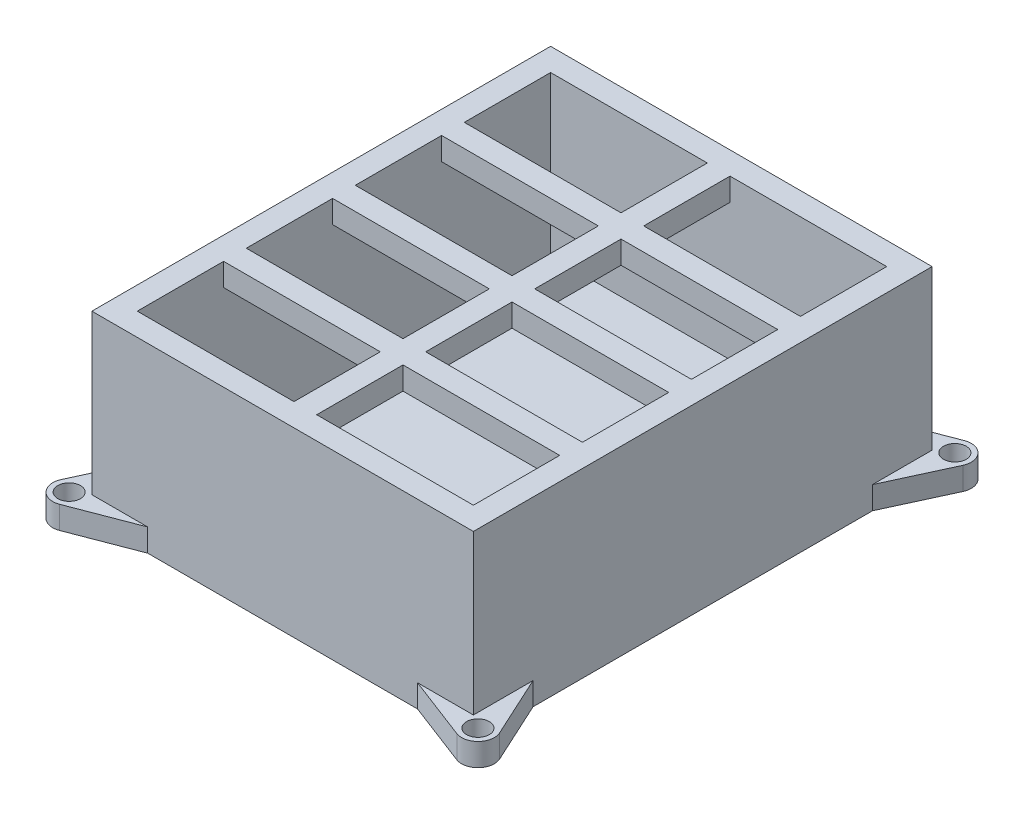
from build123d import *

# Parameters (mm, degrees)
SKETCH1_W           = 16.8
SKETCH1_H           = 20.2
SKETCH1_W_2         = 6.9
SKETCH1_H_2         = 3.8
BOSS_EXTRUDE1_DEPTH = 1
SKETCH2_W           = 16.8
SKETCH2_H           = 20.2
SKETCH2_W_2         = 6.9
SKETCH2_H_2         = 3.8
BOSS_EXTRUDE2_DEPTH = 1
SKETCH4_W           = 16.8
SKETCH4_H           = 20.2
SKETCH4_W_2         = 14.8
SKETCH4_H_2         = 18.2
BOSS_EXTRUDE3_DEPTH = 6
SKETCH5_R           = 0.5
BOSS_EXTRUDE4_DEPTH = 1


with BuildPart() as part:
    # Sketch1 → Boss-Extrude1 (new body)
    # profile 1 of 9: a face of its own
    with BuildSketch(Plane(origin=(0, 0, 0), x_dir=(1, 0, 0), z_dir=(0, 1, 0))):
        Rectangle(SKETCH1_W, SKETCH1_H)
        with Locations((3.95, 7.2)):
            Rectangle(SKETCH1_W_2, SKETCH1_H_2, mode=Mode.SUBTRACT)
        with Locations((3.95, 2.4)):
            Rectangle(SKETCH1_W_2, SKETCH1_H_2, mode=Mode.SUBTRACT)
        with Locations((-3.95, -2.4)):
            Rectangle(SKETCH1_W_2, SKETCH1_H_2, mode=Mode.SUBTRACT)
        with Locations((-3.95, -7.2)):
            Rectangle(SKETCH1_W_2, SKETCH1_H_2, mode=Mode.SUBTRACT)
        with Locations((3.95, -7.2)):
            Rectangle(SKETCH1_W_2, SKETCH1_H_2, mode=Mode.SUBTRACT)
        with Locations((3.95, -2.4)):
            Rectangle(SKETCH1_W_2, SKETCH1_H_2, mode=Mode.SUBTRACT)
        with Locations((-3.95, 7.2)):
            Rectangle(SKETCH1_W_2, SKETCH1_H_2, mode=Mode.SUBTRACT)
        with Locations((-3.95, 2.4)):
            Rectangle(SKETCH1_W_2, SKETCH1_H_2, mode=Mode.SUBTRACT)
    # profile 2 of 9: a face of its own
    with BuildSketch(Plane(origin=(0, 0, 0), x_dir=(1, 0, 0), z_dir=(0, 1, 0))):
        with Locations((-3.95, 2.4)):
            Rectangle(SKETCH1_W_2, SKETCH1_H_2)
    # profile 3 of 9: a face of its own
    with BuildSketch(Plane(origin=(0, 0, 0), x_dir=(1, 0, 0), z_dir=(0, 1, 0))):
        with Locations((-3.95, 7.2)):
            Rectangle(SKETCH1_W_2, SKETCH1_H_2)
    # profile 4 of 9: a face of its own
    with BuildSketch(Plane(origin=(0, 0, 0), x_dir=(1, 0, 0), z_dir=(0, 1, 0))):
        with Locations((3.95, 7.2)):
            Rectangle(SKETCH1_W_2, SKETCH1_H_2)
    # profile 5 of 9: a face of its own
    with BuildSketch(Plane(origin=(0, 0, 0), x_dir=(1, 0, 0), z_dir=(0, 1, 0))):
        with Locations((3.95, 2.4)):
            Rectangle(SKETCH1_W_2, SKETCH1_H_2)
    # profile 6 of 9: a face of its own
    with BuildSketch(Plane(origin=(0, 0, 0), x_dir=(1, 0, 0), z_dir=(0, 1, 0))):
        with Locations((3.95, -2.4)):
            Rectangle(SKETCH1_W_2, SKETCH1_H_2)
    # profile 7 of 9: a face of its own
    with BuildSketch(Plane(origin=(0, 0, 0), x_dir=(1, 0, 0), z_dir=(0, 1, 0))):
        with Locations((-3.95, -2.4)):
            Rectangle(SKETCH1_W_2, SKETCH1_H_2)
    # profile 8 of 9: a face of its own
    with BuildSketch(Plane(origin=(0, 0, 0), x_dir=(1, 0, 0), z_dir=(0, 1, 0))):
        with Locations((-3.95, -7.2)):
            Rectangle(SKETCH1_W_2, SKETCH1_H_2)
    # profile 9 of 9: a face of its own
    with BuildSketch(Plane(origin=(0, 0, 0), x_dir=(1, 0, 0), z_dir=(0, 1, 0))):
        with Locations((3.95, -7.2)):
            Rectangle(SKETCH1_W_2, SKETCH1_H_2)
    extrude(amount=BOSS_EXTRUDE1_DEPTH)



with BuildPart() as body_2:
    # Sketch2 → Boss-Extrude2 (new body)
    with BuildSketch(Plane(origin=(0, 7, 0), x_dir=(1, 0, 0), z_dir=(0, 1, 0))):
        Rectangle(SKETCH2_W, SKETCH2_H)
        with Locations((-3.95, -7.2)):
            Rectangle(SKETCH2_W_2, SKETCH2_H_2, mode=Mode.SUBTRACT)
        with Locations((3.95, -7.2)):
            Rectangle(SKETCH2_W_2, SKETCH2_H_2, mode=Mode.SUBTRACT)
        with Locations((3.95, -2.4)):
            Rectangle(SKETCH2_W_2, SKETCH2_H_2, mode=Mode.SUBTRACT)
        with Locations((-3.95, -2.4)):
            Rectangle(SKETCH2_W_2, SKETCH2_H_2, mode=Mode.SUBTRACT)
        with Locations((-3.95, 2.4)):
            Rectangle(SKETCH2_W_2, SKETCH2_H_2, mode=Mode.SUBTRACT)
        with Locations((3.95, 2.4)):
            Rectangle(SKETCH2_W_2, SKETCH2_H_2, mode=Mode.SUBTRACT)
        with Locations((3.95, 7.2)):
            Rectangle(SKETCH2_W_2, SKETCH2_H_2, mode=Mode.SUBTRACT)
        with Locations((-3.95, 7.2)):
            Rectangle(SKETCH2_W_2, SKETCH2_H_2, mode=Mode.SUBTRACT)
    extrude(amount=BOSS_EXTRUDE2_DEPTH)


with BuildPart() as part_1:
    add(part.part)

    add(body_2.part)  # Boss-Extrude3 merges body 2
    # Sketch4 → Boss-Extrude3 (add)
    with BuildSketch(Plane(origin=(0, 1, 0), x_dir=(1, 0, 0), z_dir=(0, 1, 0))):
        Rectangle(SKETCH4_W, SKETCH4_H)
        Rectangle(SKETCH4_W_2, SKETCH4_H_2, mode=Mode.SUBTRACT)
    extrude(amount=BOSS_EXTRUDE3_DEPTH)

    # Sketch5 → Boss-Extrude4 (add)
    # profile 1 of 4: a face of its own
    with BuildSketch(Plane.XZ):
        with BuildLine():
            Line((8.4, 7.47345081), (9.654981825, 10.198339912))
            ThreePointArc((9.654981825, 10.198339912), (9.526374462, 10.99287922), (8.741993026, 11.173373894))
            Line((8.741993026, 11.173373894), (5.940588292, 10.1))
            Line((5.940588292, 10.1), (8.4, 10.1))
            Line((8.4, 10.1), (8.4, 7.47345081))
        make_face()
        with Locations(Location((9, 10.5, 0), (0, 0, 270))):
            Circle(SKETCH5_R, mode=Mode.SUBTRACT)
    # profile 2 of 4: a face of its own
    with BuildSketch(Plane.XZ):
        with BuildLine():
            Line((9.654981825, -10.198339912), (8.4, -7.47345081))
            Line((8.4, -7.47345081), (8.4, -10.1))
            Line((8.4, -10.1), (5.940588292, -10.1))
            Line((5.940588292, -10.1), (8.741993026, -11.173373894))
            ThreePointArc((8.741993026, -11.173373894), (9.526374462, -10.99287922), (9.654981825, -10.198339912))
        make_face()
        with Locations(Location((9, -10.5, 0), (0, 0, 270))):
            Circle(SKETCH5_R, mode=Mode.SUBTRACT)
    # profile 3 of 4: a face of its own
    with BuildSketch(Plane.XZ):
        with BuildLine():
            Line((-8.4, 10.1), (-5.940588292, 10.1))
            Line((-5.940588292, 10.1), (-8.741993026, 11.173373894))
            ThreePointArc((-8.741993026, 11.173373894), (-9.526374462, 10.99287922), (-9.654981825, 10.198339912))
            Line((-9.654981825, 10.198339912), (-8.4, 7.47345081))
            Line((-8.4, 7.47345081), (-8.4, 10.1))
        make_face()
        with Locations(Location((-9, 10.5, 0), (0, 0, 270))):
            Circle(SKETCH5_R, mode=Mode.SUBTRACT)
    # profile 4 of 4: a face of its own
    with BuildSketch(Plane.XZ):
        with BuildLine():
            Line((-8.741993026, -11.173373894), (-5.940588292, -10.1))
            Line((-5.940588292, -10.1), (-8.4, -10.1))
            Line((-8.4, -10.1), (-8.4, -7.47345081))
            Line((-8.4, -7.47345081), (-9.654981825, -10.198339912))
            ThreePointArc((-9.654981825, -10.198339912), (-9.526374462, -10.99287922), (-8.741993026, -11.173373894))
        make_face()
        with Locations(Location((-9, -10.5, 0), (0, 0, 270))):
            Circle(SKETCH5_R, mode=Mode.SUBTRACT)
    extrude(amount=-BOSS_EXTRUDE4_DEPTH)


solid = part_1.part
